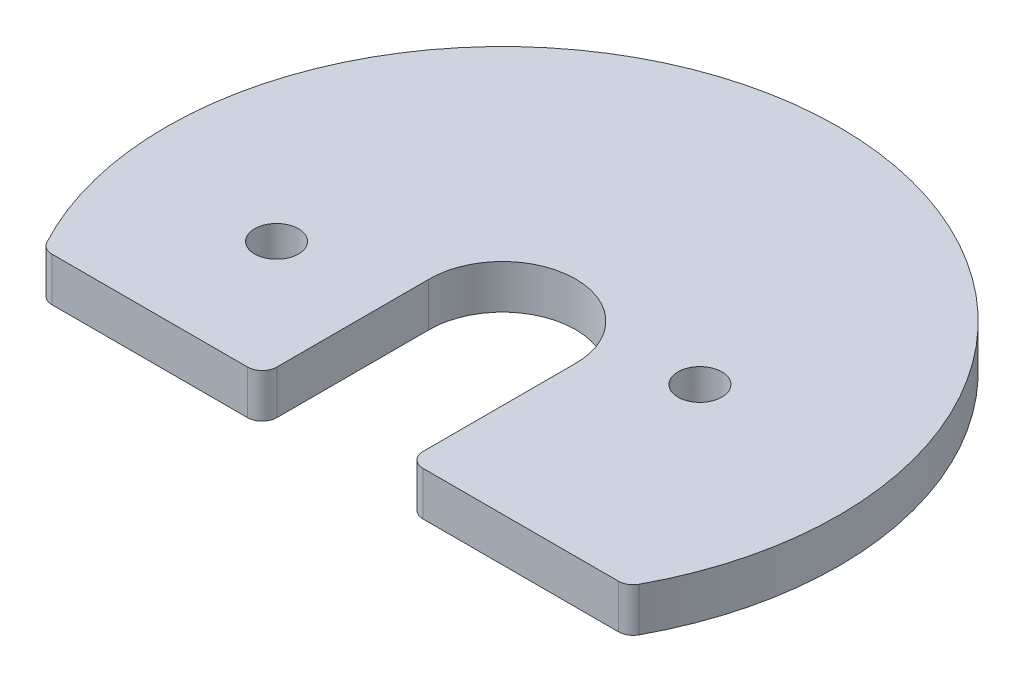
from build123d import *

# Parameters (mm, degrees)
SKETCH1_R           = 23
BOSS_EXTRUDE1_DEPTH = 3
SKETCH2_R           = 1.5
CUT_EXTRUDE1_DEPTH  = 10
SKETCH3_R           = 5
CUT_EXTRUDE2_DEPTH  = 10
CUT_EXTRUDE3_DEPTH  = 10
FILLET1_R           = 1


with BuildPart() as part:
    # Sketch1 → Boss-Extrude1 (new body)
    with BuildSketch(Plane(origin=(0, 0, 0), x_dir=(1, 0, 0), z_dir=(0, 1, 0))):
        with Locations(Location((0, 0, 0), (0, 0, 270))):
            Circle(SKETCH1_R)
    extrude(amount=BOSS_EXTRUDE1_DEPTH)

    # Sketch2 → Cut-Extrude1 (cut)
    with BuildSketch(Plane.XZ):
        with Locations(Location((-12.45, 3, 0), (0, 0, 270))):
            Circle(SKETCH2_R)
        with Locations(Location((10.5, -3, 0), (0, 0, 270))):
            Circle(SKETCH2_R)
    extrude(amount=-CUT_EXTRUDE1_DEPTH, mode=Mode.SUBTRACT)

    # Sketch3 → Cut-Extrude2 (cut)
    with BuildSketch(Plane(origin=(0, 3, 0), x_dir=(1, 0, 0), z_dir=(0, 1, 0))):
        with Locations(Location((0, 0, 0), (0, 0, 270))):
            Circle(SKETCH3_R)
    extrude(amount=-CUT_EXTRUDE2_DEPTH, mode=Mode.SUBTRACT)

    # Sketch4 → Cut-Extrude3 (cut)
    with BuildSketch(Plane(origin=(0, 3, 0), x_dir=(1, 0, 0), z_dir=(0, 1, 0))):
        Polygon((-4.999542106, 0.067666304), (-4.999542106, -6.72215), (-4.999542106, -11.432488216), (-23.949207952, -11.432488216), (-23.949207952, -24.872488216), (-5.202998913, -24.872488216), (4.797001087, -24.872488216), (29.316778345, -24.872488216), (29.316778345, -11.432488216), (4.999542106, -11.432488216), (4.999542106, 0.067666304), align=None)
    extrude(amount=-CUT_EXTRUDE3_DEPTH, mode=Mode.SUBTRACT)

    # Fillet1
    fillet1_edges = [part.edges().sort_by_distance(p)[0] for p in [
        (19.957409982, 1.5, 11.432488216),
        (4.999542106, 1.5, 11.432488216),
        (-19.957409982, 1.5, 11.432488216),
        (-4.999542106, 1.5, 11.432488216),
    ]]
    fillet(fillet1_edges, radius=FILLET1_R)


solid = part.part
